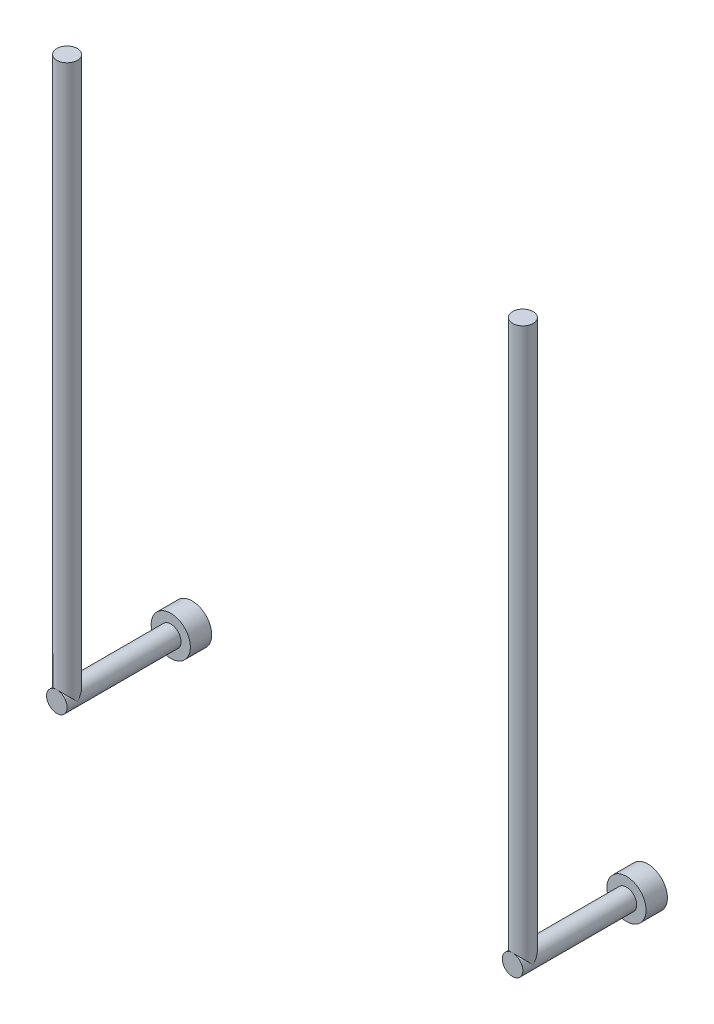
from build123d import *

# Parameters (mm, degrees)
SKETCH1_R                = 2.75
BOLT_HEAD_32_DEPTH       = 3
SKETCH2_R                = 1.44375
KEY_SHORT_ARM_32_DEPTH   = 17.99
SKETCH3_R                = 1.44375
KEY_LONG_ARM_32_DEPTH    = 78
SKETCH4_R                = 2.75
BOLT_HEAD_32_2_DEPTH     = 3
SKETCH5_R                = 1.44375
KEY_SHORT_ARM_32_2_DEPTH = 17.99
SKETCH6_R                = 1.44375
KEY_LONG_ARM_32_2_DEPTH  = 78


with BuildPart() as part:
    # Sketch1 → Bolt Head -32 (new body)
    with BuildSketch(Plane.XY.offset(14.3)):
        with Locations((-32, -20)):
            Circle(SKETCH1_R)
    extrude(amount=BOLT_HEAD_32_DEPTH)


with BuildPart() as body_2:
    # Sketch2 → Key Short Arm -32 (new body)
    with BuildSketch(Plane.XY.offset(15.31)):
        with Locations((-32, -20)):
            Circle(SKETCH2_R)
    extrude(amount=KEY_SHORT_ARM_32_DEPTH)


with BuildPart() as body_3:
    # Sketch3 → Key Long Arm -32 (new body)
    with BuildSketch(Plane(origin=(0, -20, 0), x_dir=(1, 0, 0), z_dir=(0, 1, 0))):
        with Locations(Location((-32, -31.85625, 0), (0, 0, 270))):
            Circle(SKETCH3_R)
    extrude(amount=KEY_LONG_ARM_32_DEPTH)


with BuildPart() as body_4:
    # Sketch4 → Bolt Head _32 2 (new body)
    with BuildSketch(Plane.XY.offset(14.3)):
        with Locations((32, -20)):
            Circle(SKETCH4_R)
    extrude(amount=BOLT_HEAD_32_2_DEPTH)


with BuildPart() as body_5:
    # Sketch5 → Key Short Arm _32 2 (new body)
    with BuildSketch(Plane.XY.offset(15.31)):
        with Locations((32, -20)):
            Circle(SKETCH5_R)
    extrude(amount=KEY_SHORT_ARM_32_2_DEPTH)


with BuildPart() as body_6:
    # Sketch6 → Key Long Arm _32 2 (new body)
    with BuildSketch(Plane(origin=(0, -20, 0), x_dir=(1, 0, 0), z_dir=(0, 1, 0))):
        with Locations(Location((32, -31.85625, 0), (0, 0, 270))):
            Circle(SKETCH6_R)
    extrude(amount=KEY_LONG_ARM_32_2_DEPTH)


solid = Compound([part.part, body_2.part, body_3.part, body_4.part, body_5.part, body_6.part])
